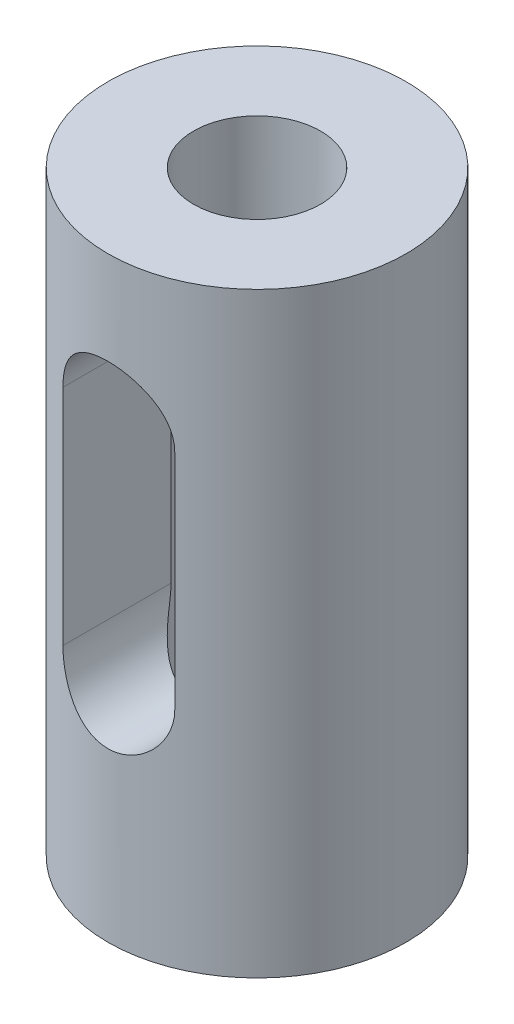
from build123d import *

# Parameters (mm, degrees)
SKETCH1_R                 = 3.175
BOSS_EXTRUDE1_DEPTH       = 12.7
TAP_DRILL_FOR_6_32_TAP1_D = 2.7051
CUT_EXTRUDE1_DEPTH        = 14.470384182
CUT_EXTRUDE1_DEPTH_BACK   = 14.470384182


with BuildPart() as part:
    # Sketch1 → Boss-Extrude1 (new body)
    with BuildSketch(Plane(origin=(0, 0, 0), x_dir=(1, 0, 0), z_dir=(0, 1, 0))):
        with Locations(Location((0, 0, 0), (0, 0, 270))):
            Circle(SKETCH1_R)
    extrude(amount=BOSS_EXTRUDE1_DEPTH)

    # Tap Drill for #6-32 Tap1 (through all)
    with Locations(Plane(origin=(0, 12.7, 0), x_dir=(1, 0, 0), z_dir=(0, 1, 0))):
        with Locations((0, 0)):
            Hole(TAP_DRILL_FOR_6_32_TAP1_D / 2)

    # Sketch4 → Cut-Extrude1 (cut, two sides: drawn at the far end of the back side and taken through both)
    with BuildSketch(Plane.XY.offset(-CUT_EXTRUDE1_DEPTH_BACK)):
        with BuildLine():
            Line((1.190625, 9.525), (1.190625, 4.7625))
            ThreePointArc((1.190625, 4.7625), (0, 3.571875), (-1.190625, 4.7625))
            Line((-1.190625, 4.7625), (-1.190625, 9.525))
            ThreePointArc((-1.190625, 9.525), (0, 10.715625), (1.190625, 9.525))
        make_face()
    extrude(amount=CUT_EXTRUDE1_DEPTH + CUT_EXTRUDE1_DEPTH_BACK, mode=Mode.SUBTRACT)


solid = part.part
